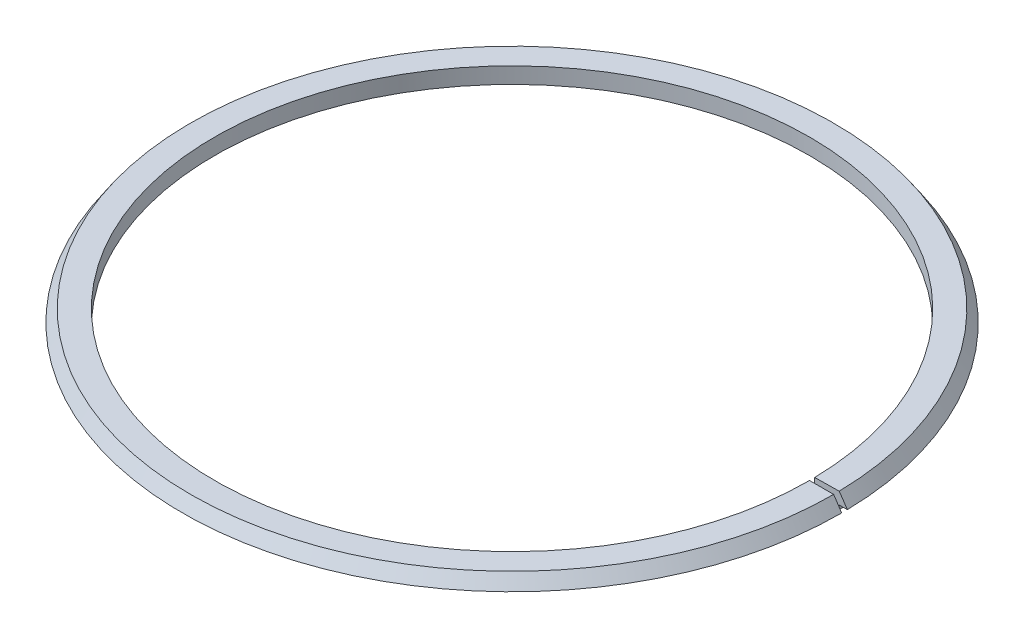
from build123d import *

# Parameters (mm, degrees)
REVOLVE_1_ANGLE = 359


with BuildPart() as part:
    # 草图1 → 旋转1 (revolve)
    with BuildSketch(Plane.XY):
        Polygon((37, 2), (37, 0), (40, 0), (40, 0.5), (41, 0.5), (40, 2), align=None)
    revolve(axis=Axis((0, 9.146153059, 0), (0, -1, 0)), revolution_arc=REVOLVE_1_ANGLE)


solid = part.part
